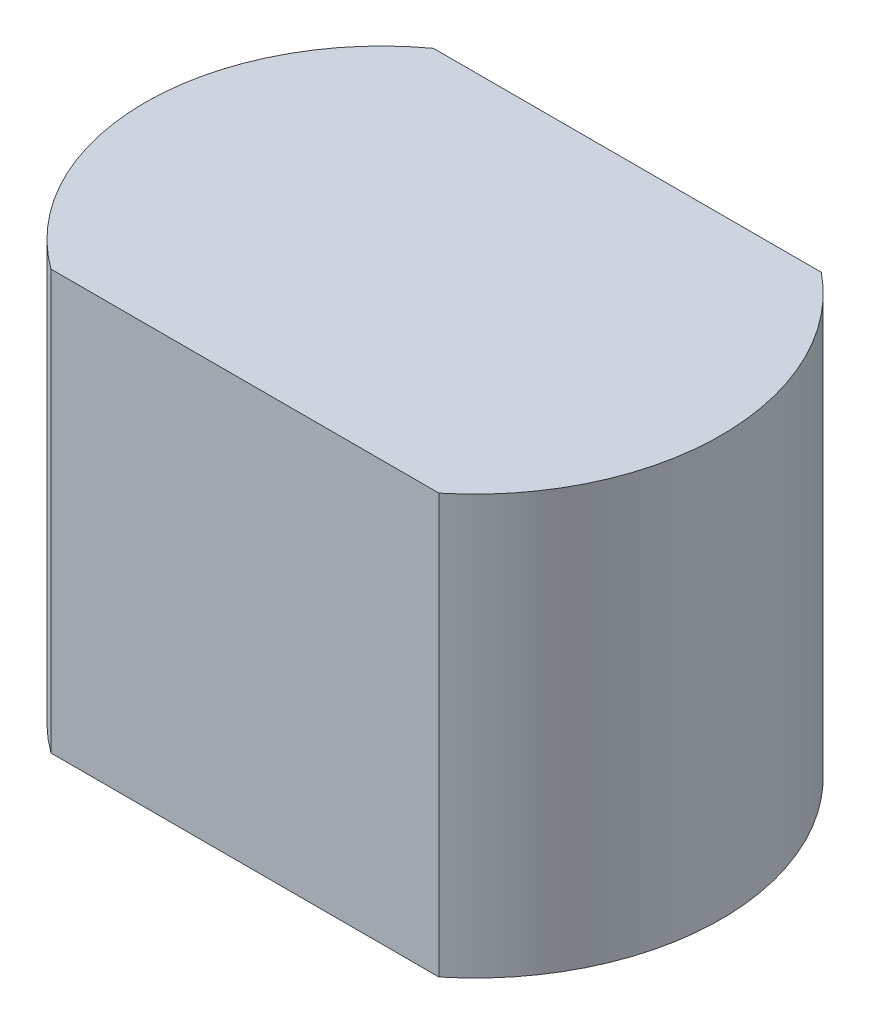
from build123d import *

# Parameters (mm, degrees)
BOSS_EXTRUDE1_DEPTH = 4


with BuildPart() as part:
    # Sketch3 → Boss-Extrude1 (new body)
    with BuildSketch(Plane(origin=(0, 0, 0), x_dir=(1, 0, 0), z_dir=(0, 1, 0))):
        with BuildLine():
            Line((-4.170883571, 2.503750098), (-0.468391857, 2.503750098))
            ThreePointArc((-0.468391857, 2.503750098), (0.401030092, 0.678750098), (-0.468391857, -1.146249902))
            Line((-0.468391857, -1.146249902), (-4.170883571, -1.146249902))
            ThreePointArc((-4.170883571, -1.146249902), (-5.098969908, 0.678750098), (-4.170883571, 2.503750098))
        make_face()
    extrude(amount=BOSS_EXTRUDE1_DEPTH)


solid = part.part
